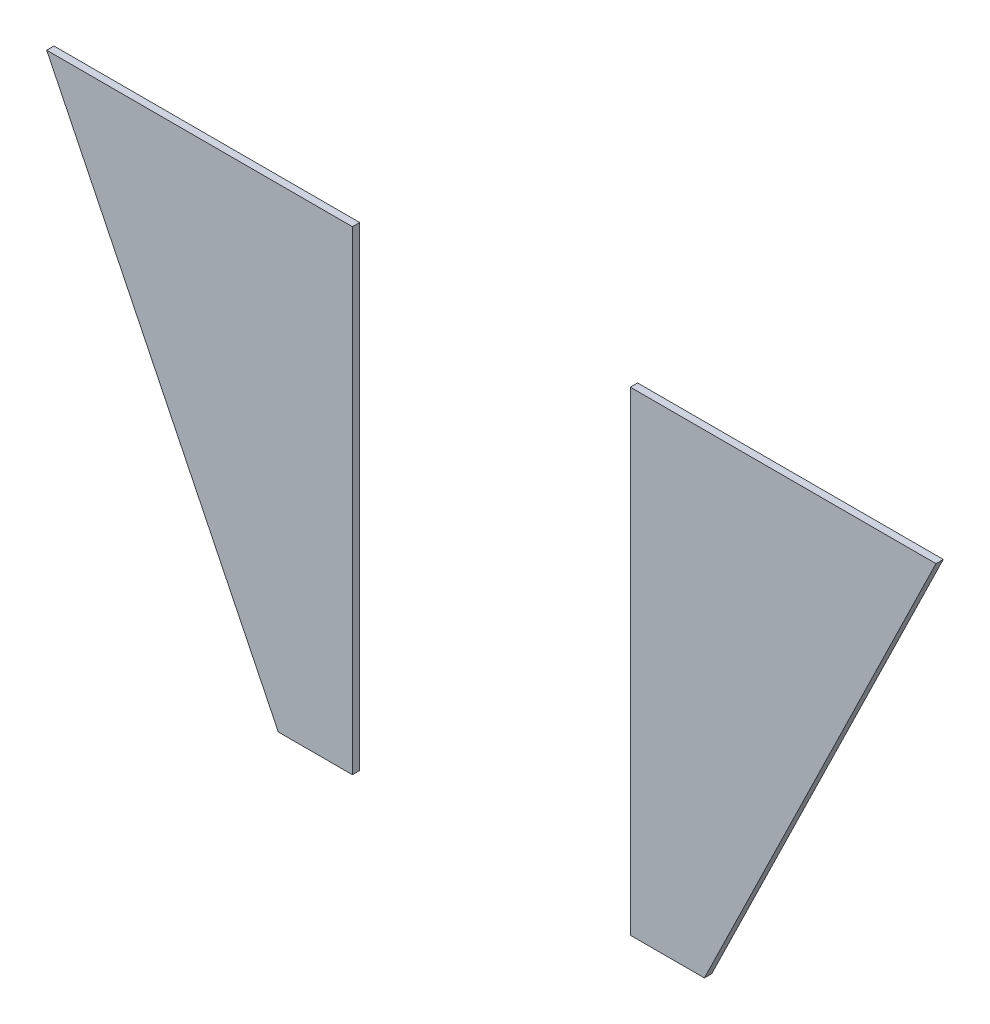
from build123d import *

# Parameters (mm, degrees)
EXTRUDE_1_DEPTH   = 5
EXTRUDE_1_2_DEPTH = 5


with BuildPart() as part:
    # 草图1 → 凸台-拉伸1 (new body)
    with BuildSketch(Plane.XY):
        Polygon((92.942718044, 2.885977654), (143.742718044, 2.885977654), (143.742718044, 328.255977654), (-65.807281956, 328.255977654), align=None)
    extrude(amount=EXTRUDE_1_DEPTH)


with BuildPart() as body_2:
    # 草图1 → Extrude 1 2 (new body)
    with BuildSketch(Plane.XY):
        Polygon((334.242718044, 328.255977654), (334.242718044, 2.885977654), (385.042718044, 2.885977654), (543.792718044, 328.255977654), align=None)
    extrude(amount=EXTRUDE_1_2_DEPTH)


solid = Compound([part.part, body_2.part])
